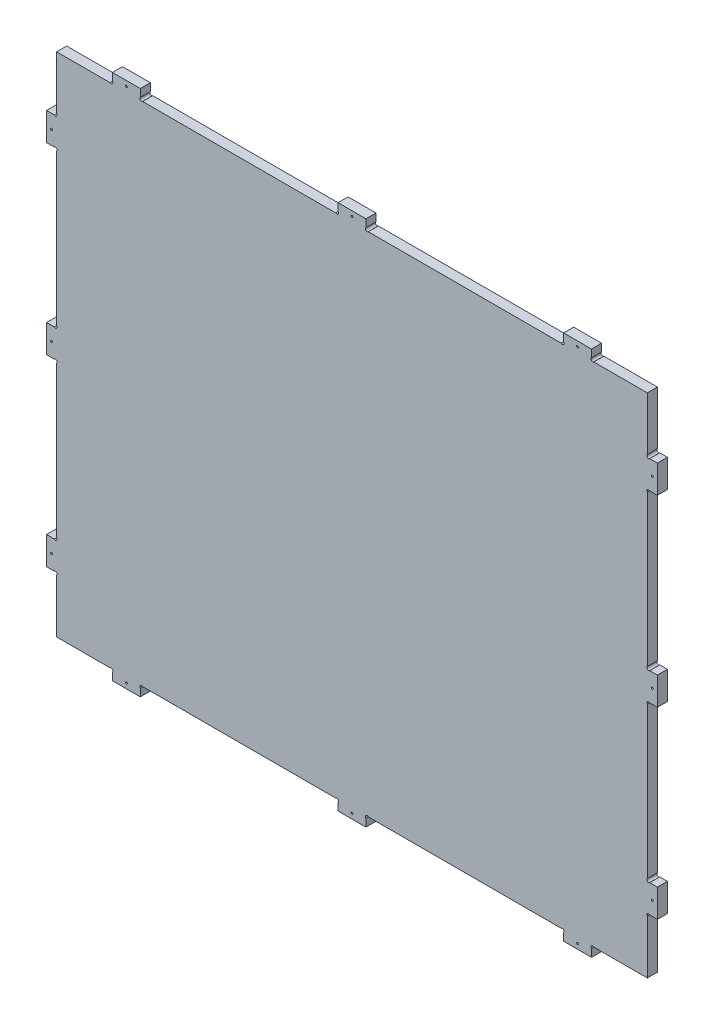
from build123d import *

# Parameters (mm, degrees)
BOSS_EXTRUDE1_DEPTH  = 18
SKETCH4_R            = 3
CUT_EXTRUDE2_DEPTH   = 30
M3_CLEARANCE_HOLE1_D = 3.4


with BuildPart() as part:
    # Sketch1 → Boss-Extrude1 (new body)
    with BuildSketch(Plane.XY):
        Polygon((-961.236516538, 328.950735931), (-961.236516538, 378.950735931), (-943.236516538, 378.950735931), (-943.236516538, 657.901471863), (-961.236516538, 657.901471863), (-961.236516538, 707.901471863), (-943.236516538, 707.901471863), (-943.236516538, 807.901471863), (-843.236516538, 807.901471863), (-843.236516538, 825.901471863), (-793.236516538, 825.901471863), (-793.236516538, 807.901471863), (-439.118258269, 807.901471863), (-439.118258269, 825.901471863), (-389.118258269, 825.901471863), (-389.118258269, 807.901471863), (-35, 807.901471863), (-35, 825.901471863), (15, 825.901471863), (15, 807.901471863), (115, 807.901471863), (115, 707.901471863), (133, 707.901471863), (133, 657.901471863), (115, 657.901471863), (115, 378.950735931), (133, 378.950735931), (133, 328.950735931), (115, 328.950735931), (115, 50), (133, 50), (133, 0), (115, 0), (115, -100), (15, -100), (15, -118), (-35, -118), (-35, -100), (-389.118258269, -100), (-389.118258269, -118), (-439.118258269, -118), (-439.118258269, -100), (-793.236516538, -100), (-793.236516538, -118), (-843.236516538, -118), (-843.236516538, -100), (-943.236516538, -100), (-943.236516538, 0), (-961.236516538, 0), (-961.236516538, 50), (-943.236516538, 50), (-943.236516538, 328.950735931), align=None)
    extrude(amount=BOSS_EXTRUDE1_DEPTH)

    # Sketch4 → Cut-Extrude2 (cut)
    with BuildSketch(Plane.XY.offset(18)):
        with Locations((-845.357836881, 810.022792206)):
            Circle(SKETCH4_R)
        with Locations((-791.115196194, 810.022792206)):
            Circle(SKETCH4_R)
        with Locations((-37.121320344, 810.022792206)):
            Circle(SKETCH4_R)
        with Locations((17.121320344, 810.022792206)):
            Circle(SKETCH4_R)
        with Locations((-441.239578612, 810.022792206)):
            Circle(SKETCH4_R)
        with Locations((-386.996937925, 810.022792206)):
            Circle(SKETCH4_R)
        with Locations((-386.996937925, -102.121320344)):
            Circle(SKETCH4_R)
        with Locations((-441.239578612, -102.121320344)):
            Circle(SKETCH4_R)
        with Locations((17.121320344, -102.121320344)):
            Circle(SKETCH4_R)
        with Locations((-37.121320344, -102.121320344)):
            Circle(SKETCH4_R)
        with Locations((-791.115196194, -102.121320344)):
            Circle(SKETCH4_R)
        with Locations((-845.357836881, -102.121320344)):
            Circle(SKETCH4_R)
        with Locations((117.121320344, 381.072056275)):
            Circle(SKETCH4_R)
        with Locations((117.121320344, 326.829415588)):
            Circle(SKETCH4_R)
        with Locations((117.121320344, 710.022792206)):
            Circle(SKETCH4_R)
        with Locations((117.121320344, 655.780151519)):
            Circle(SKETCH4_R)
        with Locations((117.121320344, 52.121320344)):
            Circle(SKETCH4_R)
        with Locations((117.121320344, -2.121320344)):
            Circle(SKETCH4_R)
        with Locations((-945.357836881, -2.121320344)):
            Circle(SKETCH4_R)
        with Locations((-945.357836881, 52.121320344)):
            Circle(SKETCH4_R)
        with Locations((-945.357836881, 655.780151519)):
            Circle(SKETCH4_R)
        with Locations((-945.357836881, 710.022792206)):
            Circle(SKETCH4_R)
        with Locations((-945.357836881, 326.829415588)):
            Circle(SKETCH4_R)
        with Locations((-945.357836881, 381.072056275)):
            Circle(SKETCH4_R)
    extrude(amount=-CUT_EXTRUDE2_DEPTH, mode=Mode.SUBTRACT)

    # M3 Clearance Hole1 (through all)
    with Locations(Plane(origin=(0, 0, 0), x_dir=(-1, 0, 0), z_dir=(0, 0, -1))):
        with Locations((-124, 682.901471863), (-124, 353.950735931), (-124, 25), (10, -109), (414.118258269, -109), (818.236516538, -109), (952.236516538, 25), (952.236516538, 353.950735931), (952.236516538, 682.901471863), (818.236516538, 816.901471863), (414.118258269, 816.901471863), (10, 816.901471863)):
            Hole(M3_CLEARANCE_HOLE1_D / 2)


solid = part.part
